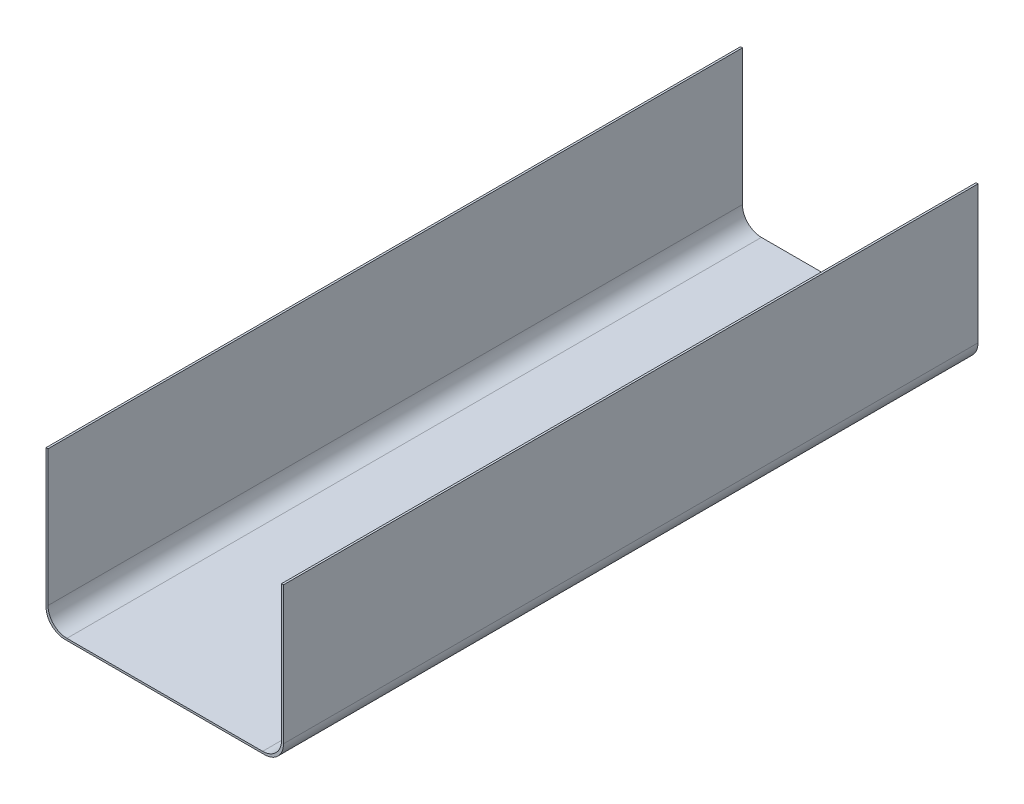
from build123d import *

# Parameters (mm, degrees)
BOSS_EXTRUDE1_DEPTH = 279.4


with BuildPart() as part:
    # Sketch1 → Boss-Extrude1 (new body)
    with BuildSketch(Plane.XY):
        with BuildLine():
            Line((46.99, 15.24), (47.78375, 15.24))
            Line((47.78375, 15.24), (47.78375, -40.16375))
            ThreePointArc((47.78375, -40.16375), (45.551903673, -45.551903673), (40.16375, -47.78375))
            Line((40.16375, -47.78375), (-40.16375, -47.78375))
            ThreePointArc((-40.16375, -47.78375), (-45.551903673, -45.551903673), (-47.78375, -40.16375))
            Line((-47.78375, -40.16375), (-47.78375, 15.24))
            Line((-47.78375, 15.24), (-46.99, 15.24))
            Line((-46.99, 15.24), (-46.99, -39.37))
            ThreePointArc((-46.99, -39.37), (-44.758153673, -44.758153673), (-39.37, -46.99))
            Line((-39.37, -46.99), (39.37, -46.99))
            ThreePointArc((39.37, -46.99), (44.758153673, -44.758153673), (46.99, -39.37))
            Line((46.99, -39.37), (46.99, 15.24))
        make_face()
    extrude(amount=BOSS_EXTRUDE1_DEPTH)


solid = part.part
